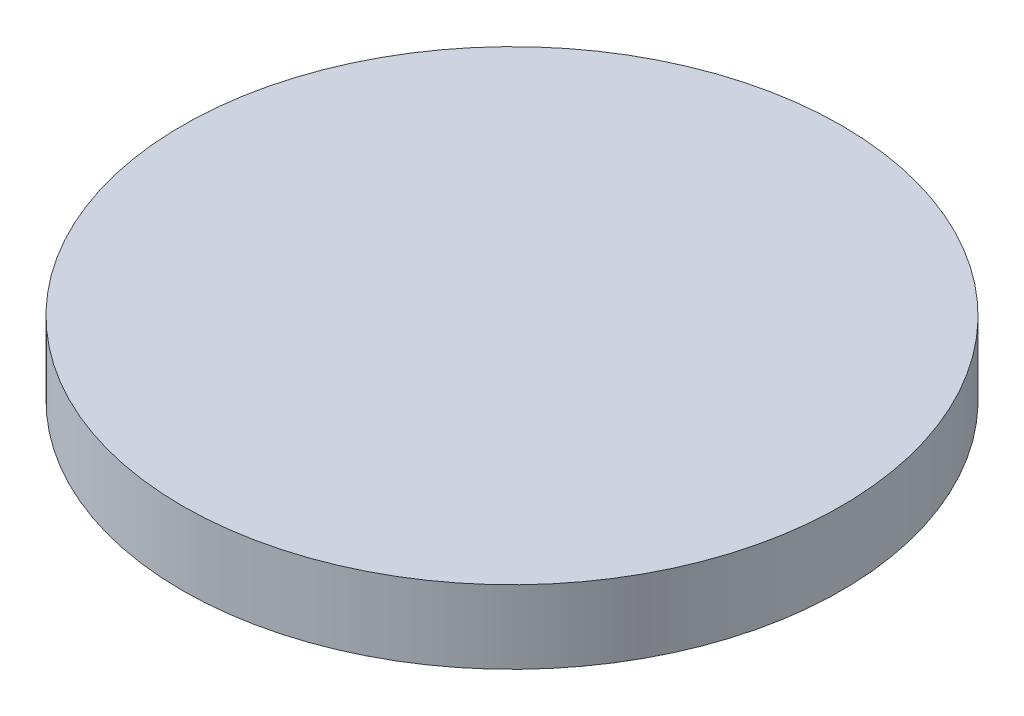
from build123d import *

# Parameters (mm, degrees)
SKETCH1_R           = 10.35
BOSS_EXTRUDE1_DEPTH = 2.3


with BuildPart() as part:
    # Sketch1 → Boss-Extrude1 (new body)
    with BuildSketch(Plane(origin=(0, 0, 0), x_dir=(1, 0, 0), z_dir=(0, 1, 0))):
        with Locations(Location((0, 0, 0), (0, 0, 270))):
            Circle(SKETCH1_R)
    extrude(amount=BOSS_EXTRUDE1_DEPTH)


solid = part.part
